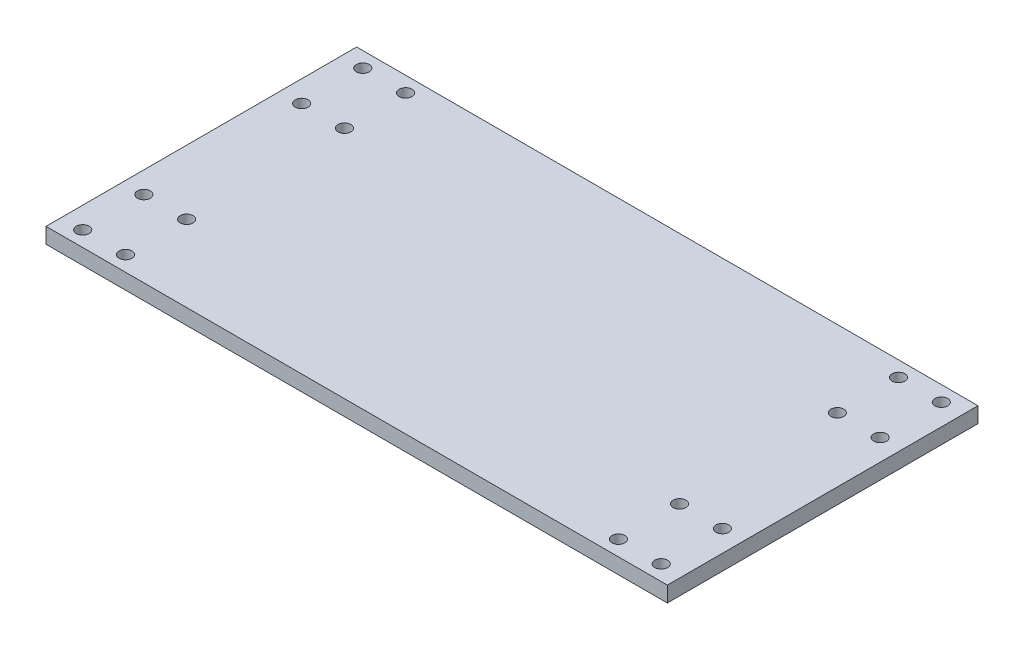
from build123d import *

# Parameters (mm, degrees)
SKETCH1_W                   = 203.2
SKETCH1_H                   = 101.6
BOSS_EXTRUDE1_DEPTH         = 5.08
TAP_DRILL_FOR_M5X0_8_TAP1_D = 4.2


with BuildPart() as part:
    # Sketch1 → Boss-Extrude1 (new body)
    with BuildSketch(Plane(origin=(0, 0, 0), x_dir=(1, 0, 0), z_dir=(0, 1, 0))):
        with Locations((101.6, -50.8)):
            Rectangle(SKETCH1_W, SKETCH1_H)
    extrude(amount=BOSS_EXTRUDE1_DEPTH)

    # Tap Drill for M5x0.8 Tap1 (through all)
    with Locations(Plane(origin=(0, 0, 0), x_dir=(-1, 0, 0), z_dir=(0, -1, 0))):
        with Locations((-196.2, -5), (-182.2, -5), (-196.2, -25), (-182.2, -25), (-21, -5), (-7, -5), (-21, -25), (-7, -25), (-7, -76.6), (-196.2, -76.6), (-182.2, -76.6), (-182.2, -96.6), (-196.2, -96.6), (-21, -76.6), (-21, -96.6), (-7, -96.6)):
            Hole(TAP_DRILL_FOR_M5X0_8_TAP1_D / 2)


solid = part.part
